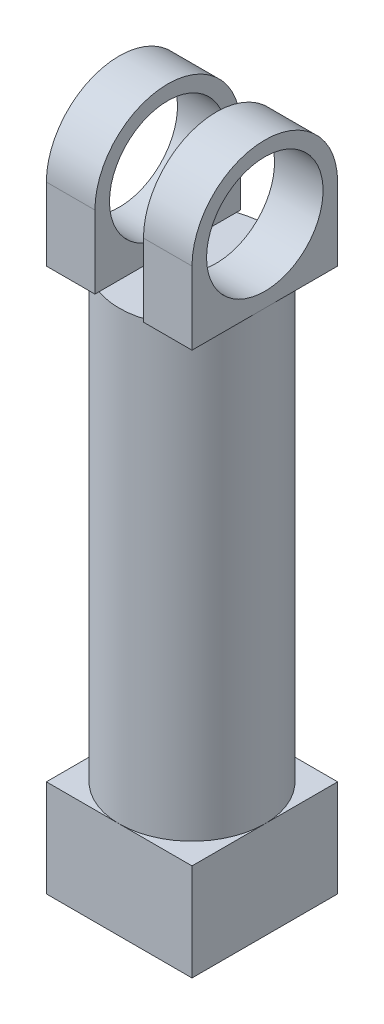
from build123d import *

# Parameters (mm, degrees)
SKETCH1_R           = 7.5
BOSS_EXTRUDE1_DEPTH = 46
SKETCH2_W           = 15
SKETCH2_H           = 15
BOSS_EXTRUDE2_DEPTH = 10
SKETCH3_R           = 2.5
CUT_EXTRUDE1_DEPTH  = 7.5
BOSS_EXTRUDE3_DEPTH = 15
CUT_EXTRUDE4_DEPTH  = 64.263338514
SKETCH6_R           = 6
CUT_EXTRUDE5_DEPTH  = 64.263338514
CUT_EXTRUDE7_START  = -5
SKETCH7_R           = 7.5
CUT_EXTRUDE7_DEPTH  = 5
CUT_EXTRUDE8_START  = -5
CUT_EXTRUDE8_DEPTH  = 5


with BuildPart() as part:
    # Sketch1 → Boss-Extrude1 (new body)
    with BuildSketch(Plane(origin=(0, 0, 0), x_dir=(1, 0, 0), z_dir=(0, 1, 0))):
        with Locations(Location((0, 0, 0), (0, 0, 270))):
            Circle(SKETCH1_R)
    extrude(amount=BOSS_EXTRUDE1_DEPTH)

    # Sketch2 → Boss-Extrude2 (add)
    with BuildSketch(Plane.XZ):
        Rectangle(SKETCH2_W, SKETCH2_H)
    extrude(amount=BOSS_EXTRUDE2_DEPTH)

    # Sketch3 → Cut-Extrude1 (cut)
    with BuildSketch(Plane.ZY.offset(7.5)):
        with Locations((0, -5)):
            Circle(SKETCH3_R)
    extrude(amount=-CUT_EXTRUDE1_DEPTH, mode=Mode.SUBTRACT)

    # Sketch4 → Boss-Extrude3 (add)
    with BuildSketch(Plane(origin=(0, 46, 0), x_dir=(1, 0, 0), z_dir=(0, 1, 0))):
        Polygon((0, 7.5), (7.5, 7.5), (7.5, -7.5), (-7.5, -7.5), (-7.5, 7.5), align=None)
    extrude(amount=BOSS_EXTRUDE3_DEPTH)

    # Sketch5 → Cut-Extrude4 (cut, through all)
    with BuildSketch(Plane.ZY.offset(7.5)):
        with BuildLine():
            ThreePointArc((-7.5, 53.5), (-5.303300859, 58.803300859), (0, 61))
            Line((0, 61), (-7.5, 61))
            Line((-7.5, 61), (-7.5, 53.5))
        make_face()
        with BuildLine():
            Line((7.5, 61), (0, 61))
            ThreePointArc((0, 61), (5.303300859, 58.803300859), (7.5, 53.5))
            Line((7.5, 53.5), (7.5, 61))
        make_face()
    extrude(amount=-CUT_EXTRUDE4_DEPTH, mode=Mode.SUBTRACT)

    # Sketch6 → Cut-Extrude5 (cut, through all)
    with BuildSketch(Plane.ZY.offset(7.5)):
        with Locations((0, 53.5)):
            Circle(SKETCH6_R)
    extrude(amount=-CUT_EXTRUDE5_DEPTH, mode=Mode.SUBTRACT)

    # Sketch7 → Cut-Extrude7 (cut)
    with BuildSketch(Plane.ZY.offset(7.5).offset(CUT_EXTRUDE7_START)):
        with Locations((0, 53.5)):
            Circle(SKETCH7_R)
    extrude(amount=-CUT_EXTRUDE7_DEPTH, mode=Mode.SUBTRACT)

    # Sketch8 → Cut-Extrude8 (cut)
    with BuildSketch(Plane.ZY.offset(7.5).offset(CUT_EXTRUDE8_START)):
        with BuildLine():
            Line((-6, 53.5), (-7.5, 53.5))
            Line((-7.5, 53.5), (-7.5, 46))
            Line((-7.5, 46), (0, 46))
            Line((0, 46), (7.5, 46))
            Line((7.5, 46), (7.5, 53.5))
            Line((7.5, 53.5), (6, 53.5))
            ThreePointArc((6, 53.5), (0, 47.5), (-6, 53.5))
        make_face()
    extrude(amount=-CUT_EXTRUDE8_DEPTH, mode=Mode.SUBTRACT)


solid = part.part
